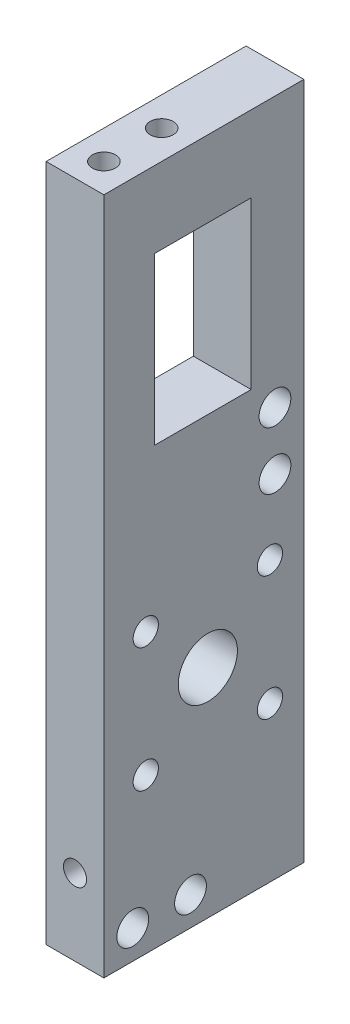
from build123d import *

# Parameters (mm, degrees)
MAIN_STOCK_START                   = 2.248090434
SKETCH_1_W                         = 4
SKETCH_1_H                         = 46.98
MAIN_STOCK_DEPTH                   = 8.851909566
SKETCH_2_R                         = 0.8
FRAME_1XD1P6_THROUGH_DEPTH         = 70.124968014
SKETCH_3_R                         = 2.05
SMA_CENTER_D4P1_DEPTH              = 4
SKETCH_4_R                         = 0.875
SMA_UPPER_2XD1P75_THROUGH_DEPTH    = 45.280835584
SKETCH_5_W                         = 6.7
SKETCH_5_H                         = 11.5
TYPEC_WINDOW_11P5X6P7_DEPTH        = 4
SKETCH_6_R                         = 1.1
CORNER_FRONT_2XD2P2_THROUGH_DEPTH  = 45.280835584
SKETCH_7_R                         = 0.8
CORNER_REAR_2XD1P6_BLIND4_DEPTH    = 4
SKETCH_8_W                         = 4
SKETCH_8_H                         = 46.98
WALL_EXTENSION_TO_FLOOR_DEPTH      = 5
SKETCH_9_R                         = 2.05
SMA_CENTER_FULL_BORE_DEPTH         = 4.01
SKETCH_10_R                        = 0.875
SMA_LOWER_M2P2_THROUGH_DEPTH       = 4.01
SKETCH_11_W                        = 6.7
SKETCH_11_H                        = 11.5
RIGHT_WINDOW_FULL_11P5X6P7_DEPTH   = 4.01
SKETCH_12_R                        = 1.1
HORIZONTAL_BASE_M2_0_0_05365_DEPTH = 4.01


with BuildPart() as part:
    # 草图1 → Main_Stock (new body)
    with BuildSketch(Plane.XY.offset(MAIN_STOCK_START)):
        with Locations((51.65, 19.19)):
            Rectangle(SKETCH_1_W, SKETCH_1_H)
    extrude(amount=MAIN_STOCK_DEPTH)

    # 草图2 → Frame_1xD1p6_Through (cut, through all)
    with BuildSketch(Plane.XY.offset(11.1)):
        with Locations((51.65, 1)):
            Circle(SKETCH_2_R)
    extrude(amount=-FRAME_1XD1P6_THROUGH_DEPTH, mode=Mode.SUBTRACT)

    # 草图3 → SMA_Center_D4p1 (cut)
    with BuildSketch(Plane(origin=(53.65, 0, 0), x_dir=(0, 0, -1), z_dir=(1, 0, 0))):
        with Locations((-3.899496327, 10.725)):
            Circle(SKETCH_3_R)
    extrude(amount=-SMA_CENTER_D4P1_DEPTH, mode=Mode.SUBTRACT)

    # 草图4 → SMA_Upper_2xD1p75_Through (cut, through all)
    with BuildSketch(Plane(origin=(53.65, 0, 0), x_dir=(0, 0, -1), z_dir=(1, 0, 0))):
        with Locations((-8.199496327, 6.425)):
            Circle(SKETCH_4_R)
        with Locations((-8.199496327, 15.025)):
            Circle(SKETCH_4_R)
    extrude(amount=-SMA_UPPER_2XD1P75_THROUGH_DEPTH, mode=Mode.SUBTRACT)

    # 草图5 → TypeC_Window_11p5x6p7 (cut)
    with BuildSketch(Plane(origin=(53.65, 0, 0), x_dir=(0, 0, -1), z_dir=(1, 0, 0))):
        with Locations((-4.25, 31.65)):
            Rectangle(SKETCH_5_W, SKETCH_5_H)
    extrude(amount=-TYPEC_WINDOW_11P5X6P7_DEPTH, mode=Mode.SUBTRACT)

    # 草图6 → Corner_Front_2xD2p2_Through (cut, through all)
    with BuildSketch(Plane(origin=(53.65, 0, 0), x_dir=(0, 0, -1), z_dir=(1, 0, 0))):
        with Locations((-5.1, -2.3)):
            Circle(SKETCH_6_R)
        with Locations((-9.1, -2.3)):
            Circle(SKETCH_6_R)
    extrude(amount=-CORNER_FRONT_2XD2P2_THROUGH_DEPTH, mode=Mode.SUBTRACT)

    # 草图7 → Corner_Rear_2xD1p6_Blind4 (cut)
    with BuildSketch(Plane(origin=(0, 42.68, 0), x_dir=(1, 0, 0), z_dir=(0, 1, 0))):
        with Locations(Location((51.65, -5.1, 0), (0, 0, 270))):
            Circle(SKETCH_7_R)
        with Locations(Location((51.65, -9.1, 0), (0, 0, 270))):
            Circle(SKETCH_7_R)
    extrude(amount=-CORNER_REAR_2XD1P6_BLIND4_DEPTH, mode=Mode.SUBTRACT)

    # 草图8 → Wall_Extension_To_Floor (add)
    with BuildSketch(Plane(origin=(0, 0, 2.248090434), x_dir=(-1, 0, 0), z_dir=(0, 0, -1))):
        with Locations((-51.65, 19.19)):
            Rectangle(SKETCH_8_W, SKETCH_8_H)
    extrude(amount=WALL_EXTENSION_TO_FLOOR_DEPTH)

    # 草图9 → SMA_Center_Full_Bore (cut)
    with BuildSketch(Plane(origin=(53.65, 0, 0), x_dir=(0, 0, -1), z_dir=(1, 0, 0))):
        with Locations((-3.899496327, 10.725)):
            Circle(SKETCH_9_R)
    extrude(amount=-SMA_CENTER_FULL_BORE_DEPTH, mode=Mode.SUBTRACT)

    # 草图10 → SMA_Lower_M2p2_Through (cut)
    with BuildSketch(Plane(origin=(53.65, 0, 0), x_dir=(0, 0, -1), z_dir=(1, 0, 0))):
        with Locations((0.400503673, 6.425)):
            Circle(SKETCH_10_R)
        with Locations((0.400503673, 15.025)):
            Circle(SKETCH_10_R)
    extrude(amount=-SMA_LOWER_M2P2_THROUGH_DEPTH, mode=Mode.SUBTRACT)

    # 草图11 → Right_Window_Full_11p5x6p7 (cut)
    with BuildSketch(Plane(origin=(53.65, 0, 0), x_dir=(0, 0, -1), z_dir=(1, 0, 0))):
        with Locations((-4.25, 31.65)):
            Rectangle(SKETCH_11_W, SKETCH_11_H)
    extrude(amount=-RIGHT_WINDOW_FULL_11P5X6P7_DEPTH, mode=Mode.SUBTRACT)

    # 草图12 → Horizontal_Base_M2_0_0.05365 (cut)
    with BuildSketch(Plane(origin=(53.65, 0, 0), x_dir=(0, 0, -1), z_dir=(1, 0, 0))):
        with Locations((0.75, 20)):
            Circle(SKETCH_12_R)
        with Locations((0.75, 24)):
            Circle(SKETCH_12_R)
    extrude(amount=-HORIZONTAL_BASE_M2_0_0_05365_DEPTH, mode=Mode.SUBTRACT)


solid = part.part
